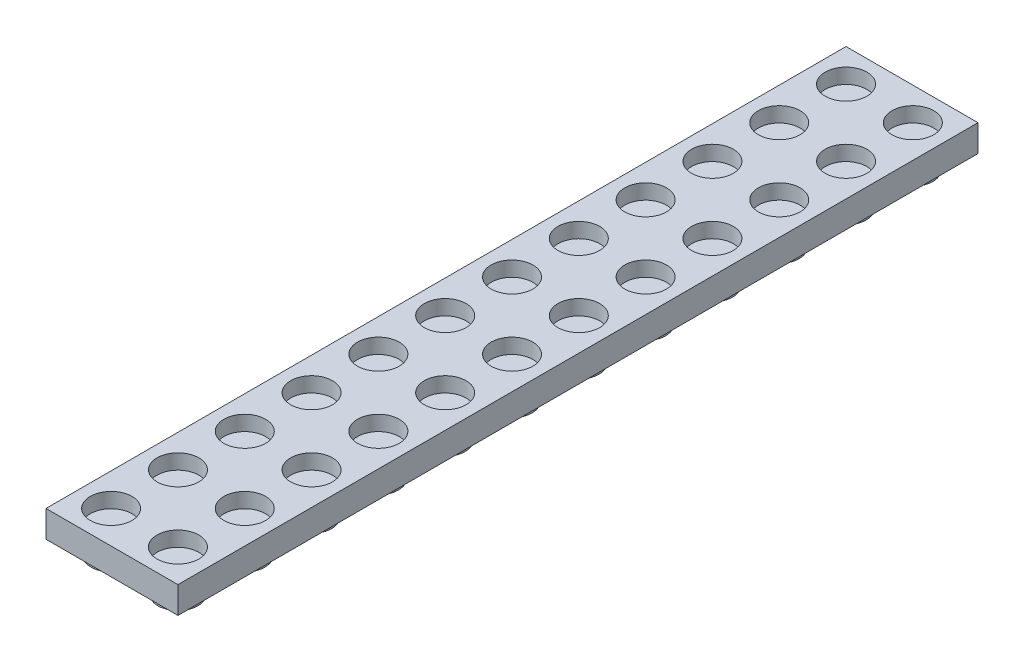
from build123d import *

# Parameters (mm, degrees)
SKETCH_1_W          = 15.8
SKETCH_1_H          = 95.8
EXTRUDE_1_DEPTH     = 3.2
SKETCH_2_R          = 2.4
EXTRUDE_3_DEPTH     = 1.7
SKETCH_3_R          = 2.5
CUT_EXTRUDE_1_DEPTH = 1.8


with BuildPart() as part:
    # Эскиз1 → Бобышка-Вытянуть1 (new body)
    with BuildSketch(Plane(origin=(0, 0, 0), x_dir=(1, 0, 0), z_dir=(0, 1, 0))):
        Rectangle(SKETCH_1_W, SKETCH_1_H)
    extrude(amount=EXTRUDE_1_DEPTH)

    # Эскиз2 → Бобышка-Вытянуть3 (add)
    with BuildSketch(Plane.XZ):
        with Locations(Location((-4, -44, 0), (0, 0, 90))):
            Circle(SKETCH_2_R)
        with Locations(Location((4, -44, 0), (0, 0, 90))):
            Circle(SKETCH_2_R)
        with Locations(Location((4, -36, 0), (0, 0, 90))):
            Circle(SKETCH_2_R)
        with Locations(Location((4, -28, 0), (0, 0, 90))):
            Circle(SKETCH_2_R)
        with Locations(Location((4, -20, 0), (0, 0, 90))):
            Circle(SKETCH_2_R)
        with Locations(Location((4, -12, 0), (0, 0, 90))):
            Circle(SKETCH_2_R)
        with Locations(Location((4, -4, 0), (0, 0, 90))):
            Circle(SKETCH_2_R)
        with Locations(Location((4, 4, 0), (0, 0, 90))):
            Circle(SKETCH_2_R)
        with Locations(Location((4, 12, 0), (0, 0, 90))):
            Circle(SKETCH_2_R)
        with Locations(Location((4, 20, 0), (0, 0, 90))):
            Circle(SKETCH_2_R)
        with Locations(Location((4, 28, 0), (0, 0, 90))):
            Circle(SKETCH_2_R)
        with Locations(Location((4, 36, 0), (0, 0, 90))):
            Circle(SKETCH_2_R)
        with Locations(Location((4, 44, 0), (0, 0, 90))):
            Circle(SKETCH_2_R)
        with Locations(Location((-4, -36, 0), (0, 0, 90))):
            Circle(SKETCH_2_R)
        with Locations(Location((-4, -28, 0), (0, 0, 90))):
            Circle(SKETCH_2_R)
        with Locations(Location((-4, -20, 0), (0, 0, 90))):
            Circle(SKETCH_2_R)
        with Locations(Location((-4, -12, 0), (0, 0, 90))):
            Circle(SKETCH_2_R)
        with Locations(Location((-4, -4, 0), (0, 0, 90))):
            Circle(SKETCH_2_R)
        with Locations(Location((-4, 4, 0), (0, 0, 90))):
            Circle(SKETCH_2_R)
        with Locations(Location((-4, 12, 0), (0, 0, 90))):
            Circle(SKETCH_2_R)
        with Locations(Location((-4, 20, 0), (0, 0, 90))):
            Circle(SKETCH_2_R)
        with Locations(Location((-4, 28, 0), (0, 0, 90))):
            Circle(SKETCH_2_R)
        with Locations(Location((-4, 36, 0), (0, 0, 90))):
            Circle(SKETCH_2_R)
        with Locations(Location((-4, 44, 0), (0, 0, 90))):
            Circle(SKETCH_2_R)
    extrude(amount=EXTRUDE_3_DEPTH)

    # Эскиз3 → Вырез-Вытянуть1 (cut)
    with BuildSketch(Plane(origin=(0, 3.2, 0), x_dir=(1, 0, 0), z_dir=(0, 1, 0))):
        with Locations(Location((-4, -44, 0), (0, 0, 270))):
            Circle(SKETCH_3_R)
        with Locations(Location((4, -44, 0), (0, 0, 270))):
            Circle(SKETCH_3_R)
        with Locations(Location((4, -36, 0), (0, 0, 270))):
            Circle(SKETCH_3_R)
        with Locations(Location((4, -28, 0), (0, 0, 270))):
            Circle(SKETCH_3_R)
        with Locations(Location((4, -20, 0), (0, 0, 270))):
            Circle(SKETCH_3_R)
        with Locations(Location((4, -12, 0), (0, 0, 270))):
            Circle(SKETCH_3_R)
        with Locations(Location((4, -4, 0), (0, 0, 270))):
            Circle(SKETCH_3_R)
        with Locations(Location((4, 4, 0), (0, 0, 270))):
            Circle(SKETCH_3_R)
        with Locations(Location((4, 12, 0), (0, 0, 270))):
            Circle(SKETCH_3_R)
        with Locations(Location((4, 20, 0), (0, 0, 270))):
            Circle(SKETCH_3_R)
        with Locations(Location((4, 28, 0), (0, 0, 270))):
            Circle(SKETCH_3_R)
        with Locations(Location((4, 36, 0), (0, 0, 270))):
            Circle(SKETCH_3_R)
        with Locations(Location((4, 44, 0), (0, 0, 270))):
            Circle(SKETCH_3_R)
        with Locations(Location((-4, -36, 0), (0, 0, 270))):
            Circle(SKETCH_3_R)
        with Locations(Location((-4, -28, 0), (0, 0, 270))):
            Circle(SKETCH_3_R)
        with Locations(Location((-4, -20, 0), (0, 0, 270))):
            Circle(SKETCH_3_R)
        with Locations(Location((-4, -12, 0), (0, 0, 270))):
            Circle(SKETCH_3_R)
        with Locations(Location((-4, -4, 0), (0, 0, 270))):
            Circle(SKETCH_3_R)
        with Locations(Location((-4, 4, 0), (0, 0, 270))):
            Circle(SKETCH_3_R)
        with Locations(Location((-4, 12, 0), (0, 0, 270))):
            Circle(SKETCH_3_R)
        with Locations(Location((-4, 20, 0), (0, 0, 270))):
            Circle(SKETCH_3_R)
        with Locations(Location((-4, 28, 0), (0, 0, 270))):
            Circle(SKETCH_3_R)
        with Locations(Location((-4, 36, 0), (0, 0, 270))):
            Circle(SKETCH_3_R)
        with Locations(Location((-4, 44, 0), (0, 0, 270))):
            Circle(SKETCH_3_R)
    extrude(amount=-CUT_EXTRUDE_1_DEPTH, mode=Mode.SUBTRACT)


solid = part.part
